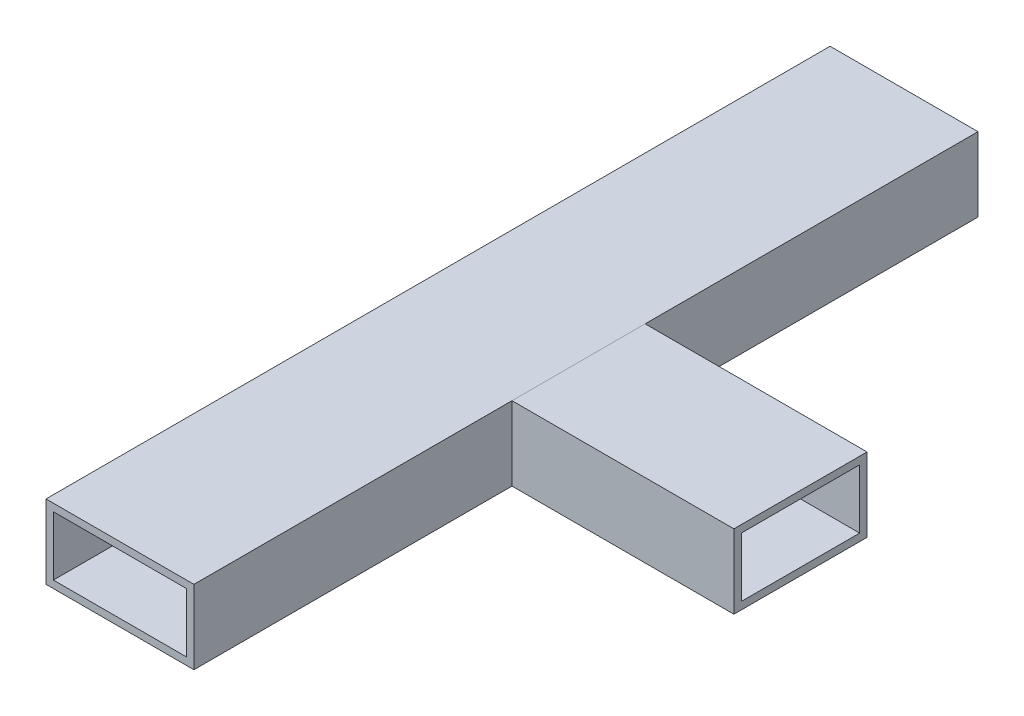
from build123d import *

# Parameters (mm, degrees)
SKETCH_1_W      = 20
SKETCH_1_H      = 10
SKETCH_1_W_2    = 18
SKETCH_1_H_2    = 8
EXTRUDE_1_DEPTH = 106
SKETCH_2_W      = 18
SKETCH_2_H      = 10
SKETCH_2_W_2    = 16
SKETCH_2_H_2    = 8
EXTRUDE_2_DEPTH = 30


with BuildPart() as part:
    # 草图1 → 凸台-拉伸1 (new body)
    with BuildSketch(Plane.XY):
        Rectangle(SKETCH_1_W, SKETCH_1_H)
        Rectangle(SKETCH_1_W_2, SKETCH_1_H_2, mode=Mode.SUBTRACT)
    extrude(amount=EXTRUDE_1_DEPTH)


with BuildPart() as body_2:
    # 草图2 → 凸台-拉伸2 (new body)
    with BuildSketch(Plane(origin=(10, 0, 0), x_dir=(0, 0, -1), z_dir=(1, 0, 0))):
        with Locations((-54, 0)):
            Rectangle(SKETCH_2_W, SKETCH_2_H)
        with Locations((-54, 0)):
            Rectangle(SKETCH_2_W_2, SKETCH_2_H_2, mode=Mode.SUBTRACT)
    extrude(amount=EXTRUDE_2_DEPTH)


solid = Compound([part.part, body_2.part])
